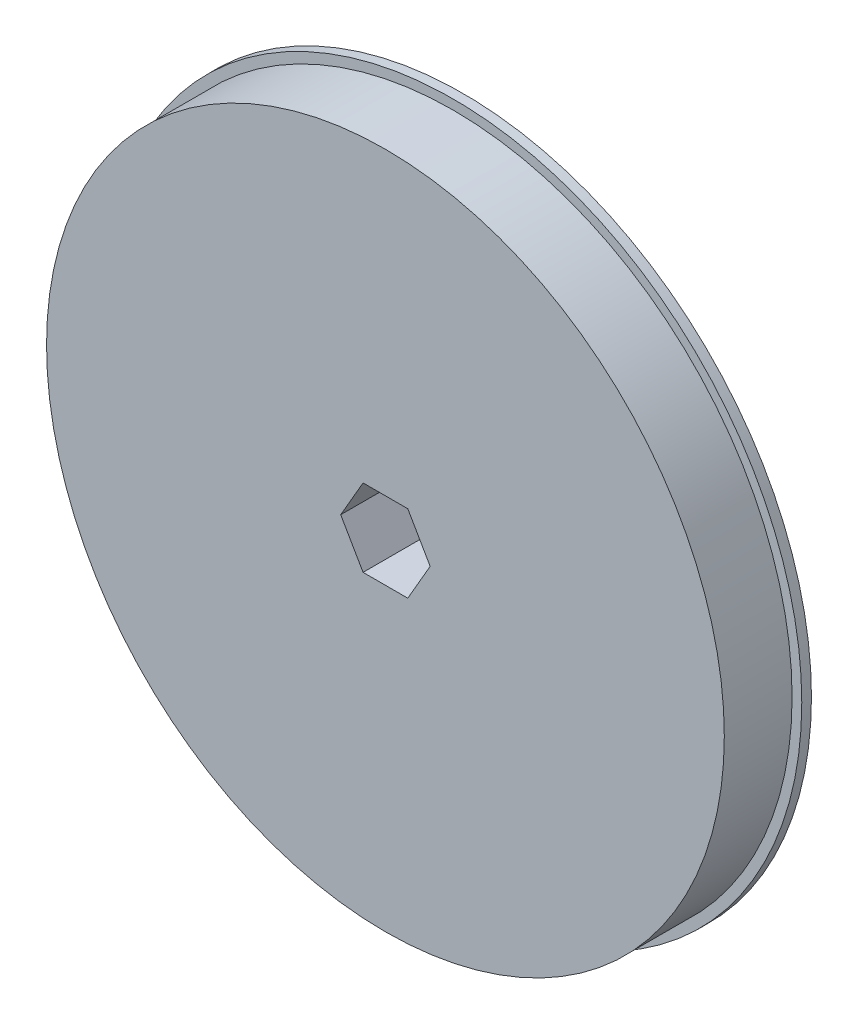
from build123d import *

# Parameters (mm, degrees)
SKETCH1_R           = 57.15
BOSS_EXTRUDE1_DEPTH = 12.7
CUT_EXTRUDE1_START  = -11.1125
SKETCH2_R           = 57.15
SKETCH2_R_2         = 55.5625
CUT_EXTRUDE1_DEPTH  = 11.1125
SKETCH3_R           = 50.8
CUT_EXTRUDE2_DEPTH  = 9.525
SKETCH4_R           = 12.7
BOSS_EXTRUDE2_DEPTH = 9.525
CUT_EXTRUDE4_DEPTH  = 12.7
CHAMFER1_SIZE       = 0.79375


with BuildPart() as part:
    # Sketch1 → Boss-Extrude1 (new body)
    with BuildSketch(Plane.XY):
        Circle(SKETCH1_R)
    extrude(amount=BOSS_EXTRUDE1_DEPTH)

    # Sketch2 → Cut-Extrude1 (cut)
    with BuildSketch(Plane.XY.offset(12.7).offset(CUT_EXTRUDE1_START)):
        Circle(SKETCH2_R)
        Circle(SKETCH2_R_2, mode=Mode.SUBTRACT)
    extrude(amount=CUT_EXTRUDE1_DEPTH, mode=Mode.SUBTRACT)

    # Sketch3 → Cut-Extrude2 (cut)
    with BuildSketch(Plane(origin=(0, 0, 0), x_dir=(-1, 0, 0), z_dir=(0, 0, -1))):
        Circle(SKETCH3_R)
    extrude(amount=-CUT_EXTRUDE2_DEPTH, mode=Mode.SUBTRACT)

    # Sketch4 → Boss-Extrude2 (add)
    with BuildSketch(Plane(origin=(0, 0, 9.525), x_dir=(-1, 0, 0), z_dir=(0, 0, -1))):
        with Locations(Location((0, 0, 0), (0, 0, 180))):
            Circle(SKETCH4_R)
    extrude(amount=BOSS_EXTRUDE2_DEPTH)

    # Sketch6 → Cut-Extrude4 (cut)
    with BuildSketch(Plane(origin=(0, 0, 0), x_dir=(-1, 0, 0), z_dir=(0, 0, -1))):
        Polygon((7.332348419, 0), (3.666174209, 6.35), (-3.666174209, 6.35), (-7.332348419, 0), (-3.666174209, -6.35), (3.666174209, -6.35), align=None)
    extrude(amount=-CUT_EXTRUDE4_DEPTH, mode=Mode.SUBTRACT)

    # Chamfer1
    chamfer1_edges = [part.edges().sort_by_distance(p)[0] for p in [
        (-12.7, 0, 0),
    ]]
    chamfer(chamfer1_edges, length=CHAMFER1_SIZE)


solid = part.part
